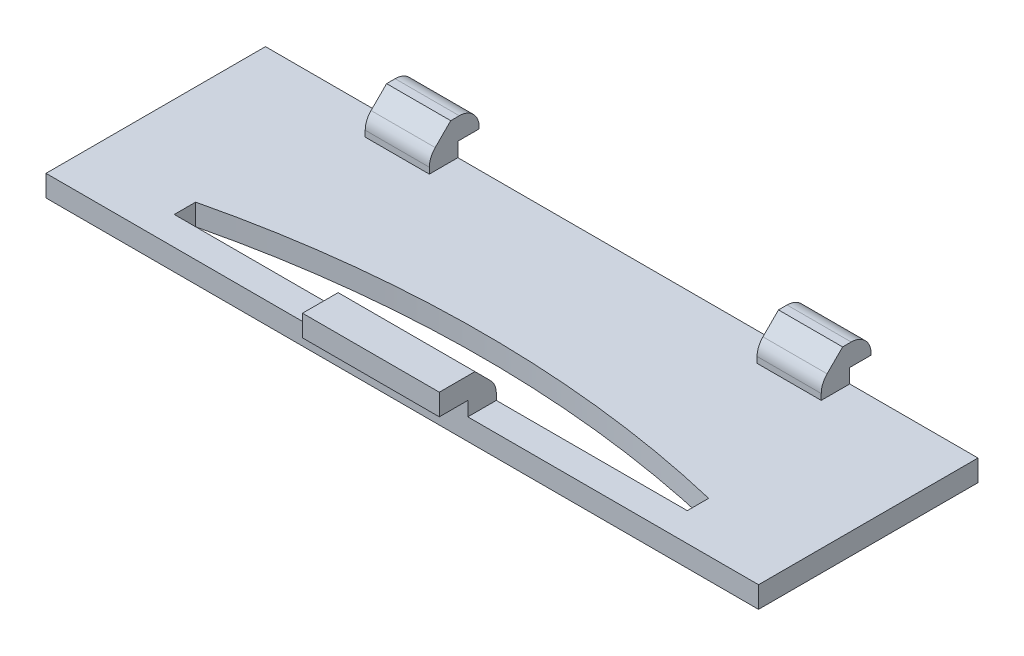
from build123d import *

# Parameters (mm, degrees)
SKETCH1_W               = 50
SKETCH1_H               = 15.4
SKETCH1_W_2             = 36
SKETCH1_H_2             = 1.5
BOSS_EXTRUDE1_DEPTH     = 1.5
SKETCH2_W               = 9.6
SKETCH2_H               = 2
SKETCH2_W_2             = 4.5
BOSS_EXTRUDE2_DEPTH     = 2.5
CHAMFER3_SIZE           = 1.5
CHAMFER4_SIZE           = 1.5
FILLET3_R               = 1.4
SKETCH5_W               = 9.6
SKETCH5_H               = 1.5
BOSS_EXTRUDE4_DEPTH     = 2
FILLET4_R               = 1.4
SKETCH6_W               = 4.5
SKETCH6_H               = 1.5
BOSS_EXTRUDE5_DEPTH     = 1.5
FILLET5_R               = 1.4
CUT_EXTRUDE5_DEPTH      = 88.490987959
CUT_EXTRUDE5_DEPTH_BACK = 88.490987959


with BuildPart() as part:
    # Sketch1 → Boss-Extrude1 (new body)
    with BuildSketch(Plane(origin=(0, 0, 0), x_dir=(1, 0, 0), z_dir=(0, 1, 0))):
        with Locations((-61.287356322, 5.044827586)):
            Rectangle(SKETCH1_W, SKETCH1_H)
        with Locations((-61.287356322, 0.094827586)):
            Rectangle(SKETCH1_W_2, SKETCH1_H_2, mode=Mode.SUBTRACT)
    extrude(amount=BOSS_EXTRUDE1_DEPTH)

    # Sketch2 → Boss-Extrude2 (add)
    with BuildSketch(Plane(origin=(0, 1.5, 0), x_dir=(1, 0, 0), z_dir=(0, 1, 0))):
        with Locations((-61.487356322, -1.655172414)):
            Rectangle(SKETCH2_W, SKETCH2_H)
        with Locations((-75.037356322, 11.744827586)):
            Rectangle(SKETCH2_W_2, SKETCH2_H)
        with Locations((-47.537356322, 11.744827586)):
            Rectangle(SKETCH2_W_2, SKETCH2_H)
    extrude(amount=BOSS_EXTRUDE2_DEPTH)

    # Chamfer3
    chamfer3_edges = [part.edges().sort_by_distance(p)[0] for p in [
        (-75.037356322, 4, -10.744827586),
    ]]
    chamfer(chamfer3_edges, length=CHAMFER3_SIZE)

    # Chamfer4
    chamfer4_edges = [part.edges().sort_by_distance(p)[0] for p in [
        (-61.487356322, 4, 0.655172414),
        (-47.537356322, 4, -10.744827586),
    ]]
    chamfer(chamfer4_edges, length=CHAMFER4_SIZE)

    # Fillet3
    fillet3_edges = [part.edges().sort_by_distance(p)[0] for p in [
        (-75.037356322, 2.5, -10.744827586),
        (-47.537356322, 2.5, -10.744827586),
    ]]
    fillet(fillet3_edges, radius=FILLET3_R)

    # Sketch5 → Boss-Extrude4 (add)
    with BuildSketch(Plane.XY.offset(2.655172414)):
        with Locations((-61.487356322, 3.25)):
            Rectangle(SKETCH5_W, SKETCH5_H)
    extrude(amount=BOSS_EXTRUDE4_DEPTH)

    # Fillet4
    fillet4_edges = [part.edges().sort_by_distance(p)[0] for p in [
        (-61.487356322, 2.5, 0.655172414),
    ]]
    fillet(fillet4_edges, radius=FILLET4_R)

    # Sketch6 → Boss-Extrude5 (add)
    with BuildSketch(Plane(origin=(0, 0, -12.744827586), x_dir=(-1, 0, 0), z_dir=(0, 0, -1))):
        with Locations((47.537356322, 3.25)):
            Rectangle(SKETCH6_W, SKETCH6_H)
        with Locations((75.037356322, 3.25)):
            Rectangle(SKETCH6_W, SKETCH6_H)
    extrude(amount=BOSS_EXTRUDE5_DEPTH)

    # Fillet5
    fillet5_edges = [part.edges().sort_by_distance(p)[0] for p in [
        (-47.537356322, 4, -14.244827586),
        (-75.037356322, 4, -14.244827586),
    ]]
    fillet(fillet5_edges, radius=FILLET5_R)

    # Sketch7 → Cut-Extrude5 (cut, two sides: drawn at the far end of the back side and taken through both)
    with BuildSketch(Plane(origin=(0, 1.5, 0), x_dir=(1, 0, 0), z_dir=(0, 1, 0)).offset(-CUT_EXTRUDE5_DEPTH_BACK)):
        with BuildLine():
            Line((-79.287356322, 0.844827586), (-43.287356322, 0.844827586))
            ThreePointArc((-43.287356322, 0.844827586), (-61.287356322, 2.968136908), (-79.287356322, 0.844827586))
        make_face()
    extrude(amount=CUT_EXTRUDE5_DEPTH + CUT_EXTRUDE5_DEPTH_BACK, mode=Mode.SUBTRACT)


solid = part.part
